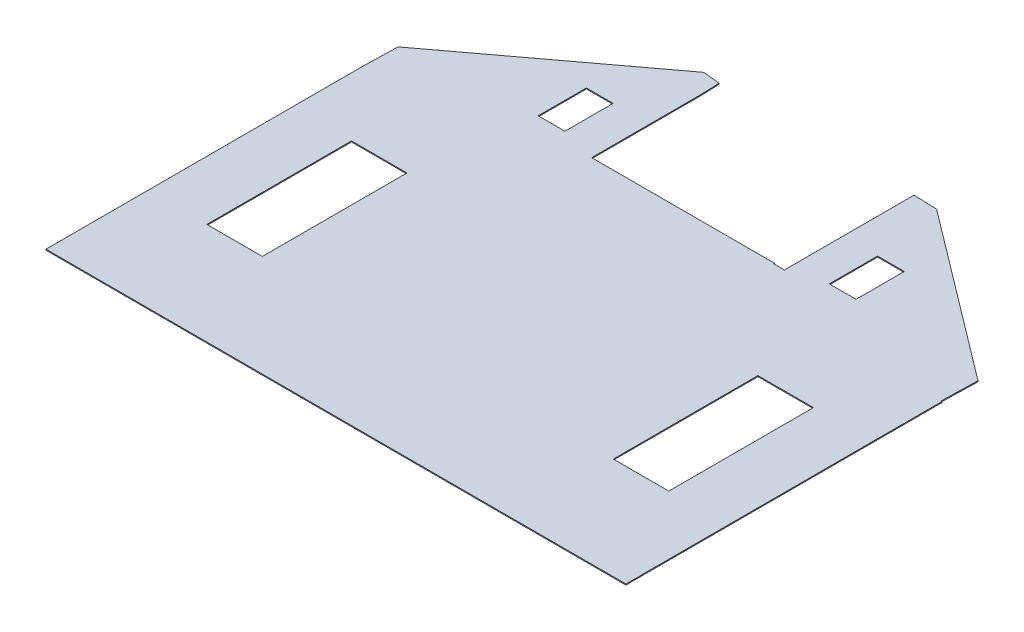
from build123d import *

# Parameters (mm, degrees)
BOSS_EXTRUDE1_DEPTH     = 1
SKETCH3_W               = 56
SKETCH3_H               = 146
CUT_EXTRUDE2_DEPTH      = 10
CUT_EXTRUDE4_DEPTH      = 607.465859368
CUT_EXTRUDE4_DEPTH_BACK = 607.465859368
SKETCH4_W               = 323.526326174
SKETCH4_H               = 73.784869865
SKETCH5_W               = 0.9
SKETCH5_H               = 318.91
BOSS_EXTRUDE2_DEPTH     = 1
CUT_EXTRUDE6_DEPTH      = 558.674774622
CUT_EXTRUDE6_DEPTH_BACK = 11.5
SKETCH6_W               = 184.6
SKETCH6_H               = 110.039837523
CUT_EXTRUDE7_DEPTH      = 558.674774622
CUT_EXTRUDE7_DEPTH_BACK = 558.674774622
SKETCH7_W               = 27
SKETCH7_H               = 48.713018504
CUT_EXTRUDE8_DEPTH      = 558.674774622
CUT_EXTRUDE8_DEPTH_BACK = 558.674774622
SKETCH8_W               = 268.184865131
SKETCH8_H               = 40.991987157
BOSS_EXTRUDE3_DEPTH     = 1
CUT_EXTRUDE9_DEPTH      = 559.688754003
CUT_EXTRUDE9_DEPTH_BACK = 559.688754003


with BuildPart() as part:
    # Sketch1 → Boss-Extrude1 (new body)
    with BuildSketch(Plane(origin=(0, 0, 0), x_dir=(1, 0, 0), z_dir=(0, 1, 0))):
        Polygon((-292.25, 307.91829646), (-292.25, -10.99170354), (292.25, -10.99170354), (292.25, 307.91829646), (0, 531.403590578), align=None)
    extrude(amount=BOSS_EXTRUDE1_DEPTH)

    # Sketch3 → Cut-Extrude2 (cut)
    with BuildSketch(Plane(origin=(0, 1, 0), x_dir=(1, 0, 0), z_dir=(0, 1, 0))):
        with Locations((-204.688244909, 164.834464834)):
            Rectangle(SKETCH3_W, SKETCH3_H)
        with Locations((205.588244909, 164.834464834)):
            Rectangle(SKETCH3_W, SKETCH3_H)
    extrude(amount=-CUT_EXTRUDE2_DEPTH, mode=Mode.SUBTRACT)

    # Sketch4 → Cut-Extrude4 (cut, two sides: drawn at the far end of the back side and taken through both)
    with BuildSketch(Plane(origin=(0, 1, 0), x_dir=(1, 0, 0), z_dir=(0, 1, 0)).offset(-CUT_EXTRUDE4_DEPTH_BACK)):
        with Locations((-21.051035773, 511.300731392)):
            Rectangle(SKETCH4_W, SKETCH4_H)
    extrude(amount=CUT_EXTRUDE4_DEPTH + CUT_EXTRUDE4_DEPTH_BACK, mode=Mode.SUBTRACT)

    # Sketch5 → Boss-Extrude2 (add)
    with BuildSketch(Plane(origin=(0, 1, 0), x_dir=(1, 0, 0), z_dir=(0, 1, 0))):
        with Locations((292.7, 148.46329646)):
            Rectangle(SKETCH5_W, SKETCH5_H)
    extrude(amount=-BOSS_EXTRUDE2_DEPTH)

    # Sketch6 → Cut-Extrude6 (cut, two sides: drawn at the far end of the back side and taken through both)
    with BuildSketch(Plane(origin=(0, 1, 0), x_dir=(1, 0, 0), z_dir=(0, 1, 0)).offset(-CUT_EXTRUDE6_DEPTH_BACK)):
        with Locations((-4.55, 399.428215222)):
            Rectangle(SKETCH6_W, SKETCH6_H)
    extrude(amount=CUT_EXTRUDE6_DEPTH + CUT_EXTRUDE6_DEPTH_BACK, mode=Mode.SUBTRACT)

    # Sketch7 → Cut-Extrude7 (cut, two sides: drawn at the far end of the back side and taken through both)
    with BuildSketch(Plane(origin=(0, 1, 0), x_dir=(1, 0, 0), z_dir=(0, 1, 0)).offset(-CUT_EXTRUDE7_DEPTH_BACK)):
        with Locations((-146.945577185, 378.369305764)):
            Rectangle(SKETCH7_W, SKETCH7_H)
        with Locations((146.945577185, 378.369305764)):
            Rectangle(SKETCH7_W, SKETCH7_H)
    extrude(amount=CUT_EXTRUDE7_DEPTH + CUT_EXTRUDE7_DEPTH_BACK, mode=Mode.SUBTRACT)

    # Sketch8 → Cut-Extrude8 (cut, two sides: drawn at the far end of the back side and taken through both)
    with BuildSketch(Plane(origin=(0, 1, 0), x_dir=(1, 0, 0), z_dir=(0, 1, 0)).offset(-CUT_EXTRUDE8_DEPTH_BACK)):
        with Locations((19.664678058, 474.092644014)):
            Rectangle(SKETCH8_W, SKETCH8_H)
    extrude(amount=CUT_EXTRUDE8_DEPTH + CUT_EXTRUDE8_DEPTH_BACK, mode=Mode.SUBTRACT)

    # Sketch9 → Boss-Extrude3 (add)
    with BuildSketch(Plane(origin=(0, 1, 0), x_dir=(1, 0, 0), z_dir=(0, 1, 0))):
        Polygon((-292.25, 307.91829646), (-291.361, 343.51929646), (-114.760549692, 475.59983321), (-97.590157883, 473.756060592), (-96.85, 453.596650435), (-101.74753711, 453.596650435), align=None)
        Polygon((87.75, 453.596650435), (87.75, 474.677946901), (122.261, 473.51929646), (293.15, 344.40829646), (292.25, 307.91829646), (101.74753711, 453.596650435), align=None)
    extrude(amount=-BOSS_EXTRUDE3_DEPTH)

    # Sketch10 → Cut-Extrude9 (cut, two sides: drawn at the far end of the back side and taken through both)
    with BuildSketch(Plane(origin=(0, 1, 0), x_dir=(1, 0, 0), z_dir=(0, 1, 0)).offset(-CUT_EXTRUDE9_DEPTH_BACK)):
        Polygon((87.75, 474.677946901), (98.639, 474.40829646), (98.639, 343.51929646), (87.75, 343.51929646), align=None)
    extrude(amount=CUT_EXTRUDE9_DEPTH + CUT_EXTRUDE9_DEPTH_BACK, mode=Mode.SUBTRACT)


solid = part.part
